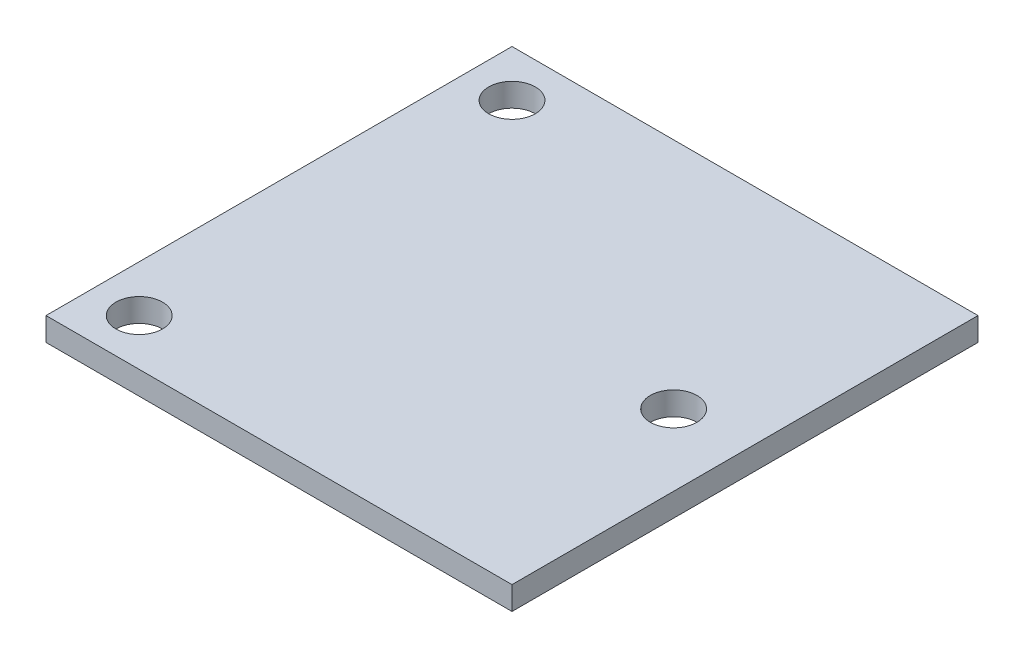
from build123d import *

# Parameters (mm, degrees)
SKETCH1_W           = 127
SKETCH1_H           = 127
SKETCH1_R           = 6.35
BOSS_EXTRUDE1_DEPTH = 6.35


with BuildPart() as part:
    # Sketch1 → Boss-Extrude1 (new body)
    with BuildSketch(Plane(origin=(0, 0, 0), x_dir=(1, 0, 0), z_dir=(0, 1, 0))):
        with Locations((63.5, 0)):
            Rectangle(SKETCH1_W, SKETCH1_H)
        with Locations(Location((12.7, 50.8, 0), (0, 0, 270))):
            Circle(SKETCH1_R, mode=Mode.SUBTRACT)
        with Locations(Location((12.7, -50.8, 0), (0, 0, 270))):
            Circle(SKETCH1_R, mode=Mode.SUBTRACT)
        with Locations(Location((107.550712, 0, 0), (0, 0, 270))):
            Circle(SKETCH1_R, mode=Mode.SUBTRACT)
    extrude(amount=BOSS_EXTRUDE1_DEPTH)


solid = part.part
